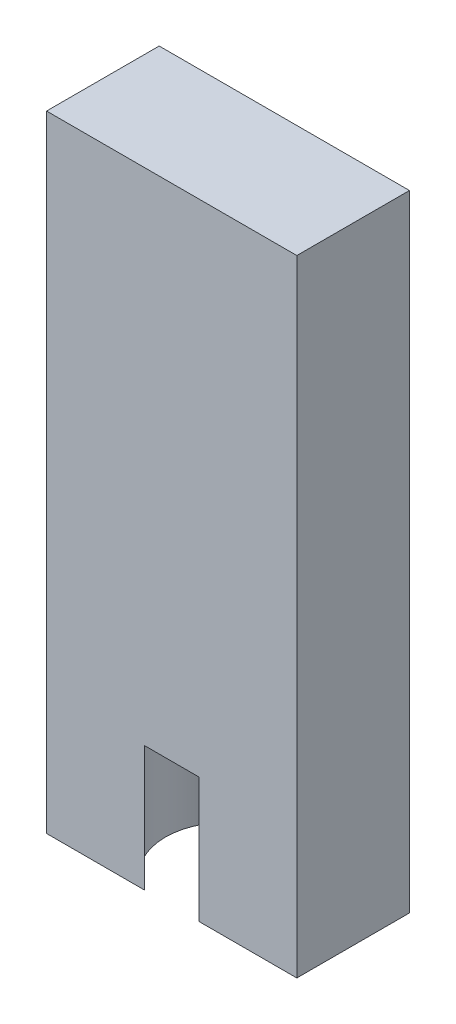
from build123d import *

# Parameters (mm, degrees)
SKETCH1_W           = 40
SKETCH1_H           = 18
BOSS_EXTRUDE1_DEPTH = 100
SKETCH3_R           = 10
SKETCH3_R_2         = 5
CUT_EXTRUDE2_DEPTH  = 20


with BuildPart() as part:
    # Sketch1 → Boss-Extrude1 (new body)
    with BuildSketch(Plane(origin=(0, 0, 0), x_dir=(1, 0, 0), z_dir=(0, 1, 0))):
        Rectangle(SKETCH1_W, SKETCH1_H)
    extrude(amount=BOSS_EXTRUDE1_DEPTH)

    # Sketch3 → Cut-Extrude2 (cut)
    with BuildSketch(Plane.XZ):
        Circle(SKETCH3_R)
        with Locations((0, 22)):
            Circle(SKETCH3_R_2)
        with Locations((0, -22)):
            Circle(SKETCH3_R_2)
    extrude(amount=-CUT_EXTRUDE2_DEPTH, mode=Mode.SUBTRACT)


solid = part.part
